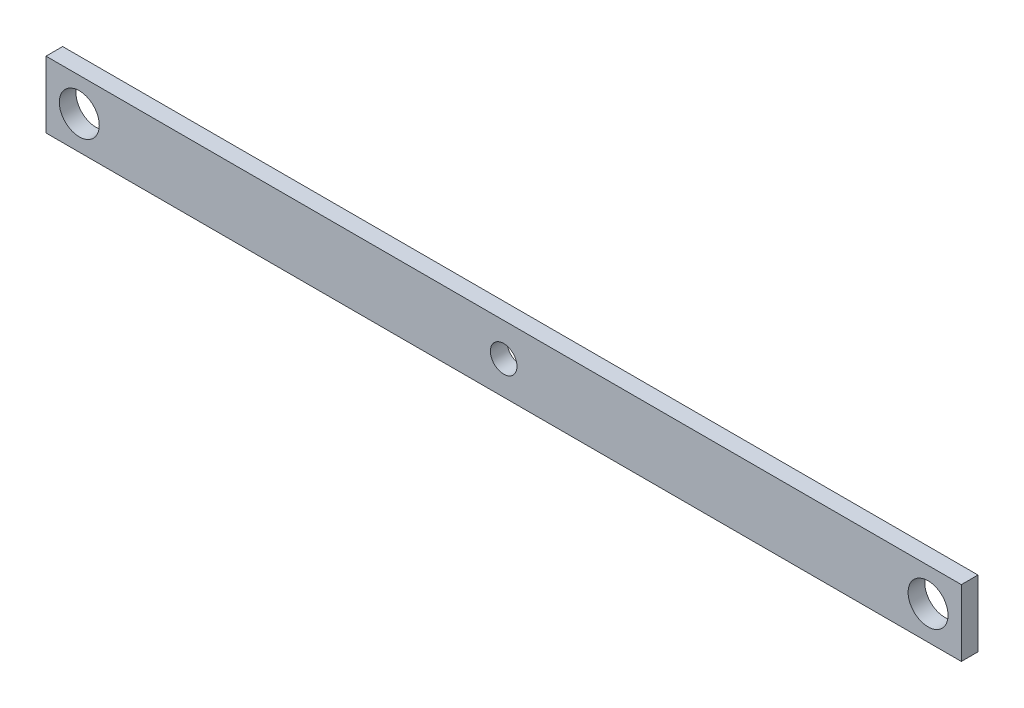
from build123d import *

# Parameters (mm, degrees)
SKETCH_1_W      = 275
SKETCH_1_H      = 20
SKETCH_1_R      = 4
SKETCH_1_R_2    = 6
EXTRUDE_1_DEPTH = 5


with BuildPart() as part:
    # 草图1 → 凸台-拉伸1 (new body)
    with BuildSketch(Plane.XY):
        Rectangle(SKETCH_1_W, SKETCH_1_H)
        Circle(SKETCH_1_R, mode=Mode.SUBTRACT)
        with Locations((-127.5, 0)):
            Circle(SKETCH_1_R_2, mode=Mode.SUBTRACT)
        with Locations((127.5, 0)):
            Circle(SKETCH_1_R_2, mode=Mode.SUBTRACT)
    extrude(amount=EXTRUDE_1_DEPTH)


solid = part.part
